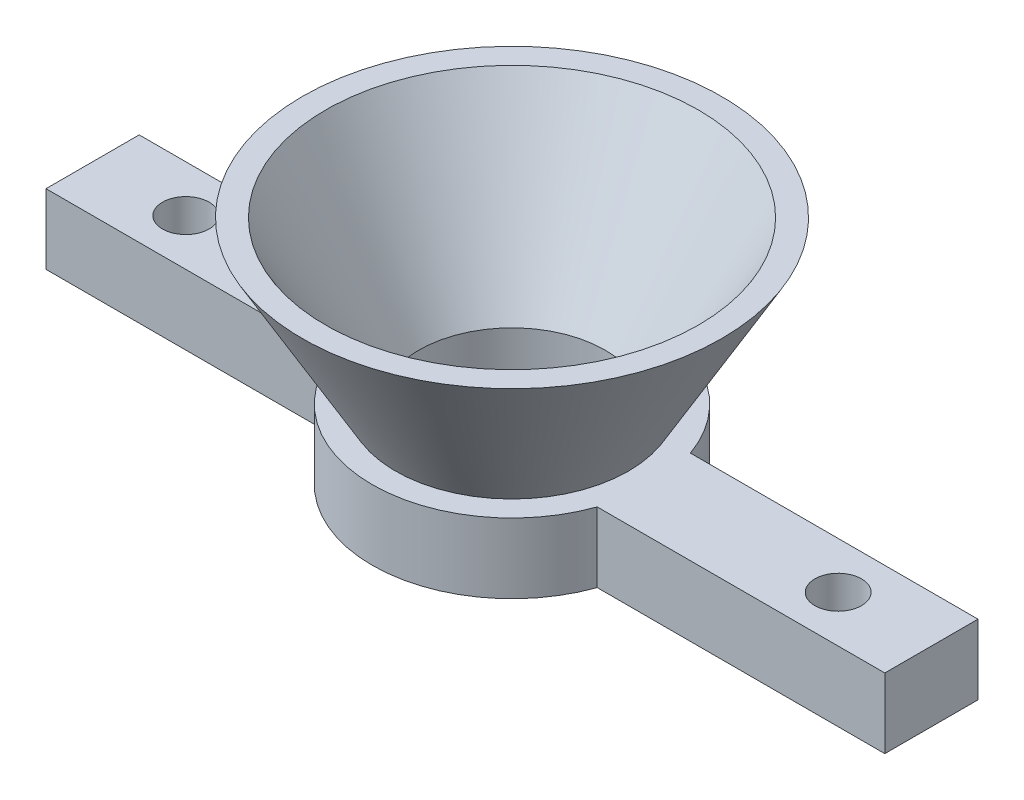
from build123d import *

# Parameters (mm, degrees)
SKETCH1_R           = 0.79375
BOSS_EXTRUDE1_DEPTH = 1.190625


with BuildPart() as part:
    # Sketch1 → Boss-Extrude1 (new, symmetric)
    # profile 1 of 14: a face of its own
    with BuildSketch(Plane(origin=(0, 0, 0), x_dir=(1, 0, 0), z_dir=(0, 1, 0))):
        with BuildLine():
            ThreePointArc((-4.682314967, -0.870248702), (-4.742411374, -0.436967517), (-4.7625, 0))
            ThreePointArc((-4.7625, 0), (-4.69391314, 0.805348174), (-4.490128061, 1.5875))
            Line((-4.490128061, 1.5875), (-14.2875, 1.5875))
            Line((-14.2875, 1.5875), (-14.2875, -1.5875))
            Line((-14.2875, -1.5875), (-5.924630657, -1.5875))
            Line((-5.924630657, -1.5875), (-4.682314967, -0.870248702))
        make_face()
        with Locations(Location((-11.1125, 0, 0), (0, 0, 90))):
            Circle(SKETCH1_R, mode=Mode.SUBTRACT)
    # profile 2 of 14: a face of its own
    with BuildSketch(Plane(origin=(0, 0, 0), x_dir=(1, 0, 0), z_dir=(0, 1, 0))):
        with BuildLine():
            ThreePointArc((-2.749630657, 1.5875), (0, 3.175), (2.749630657, 1.5875))
            Line((2.749630657, 1.5875), (4.490128061, 1.5875))
            ThreePointArc((4.490128061, 1.5875), (0, 4.7625), (-4.490128061, 1.5875))
            Line((-4.490128061, 1.5875), (-2.749630657, 1.5875))
        make_face()
    # profile 3 of 14: a face of its own
    with BuildSketch(Plane(origin=(0, 0, 0), x_dir=(1, 0, 0), z_dir=(0, 1, 0))):
        with BuildLine():
            ThreePointArc((4.490128061, 1.5875), (4.69391314, 0.805348174), (4.7625, 0))
            ThreePointArc((4.7625, 0), (4.742411374, -0.436967517), (4.682314967, -0.870248702))
            Line((4.682314967, -0.870248702), (5.924630657, -1.5875))
            Line((5.924630657, -1.5875), (14.2875, -1.5875))
            Line((14.2875, -1.5875), (14.2875, 1.5875))
            Line((14.2875, 1.5875), (4.490128061, 1.5875))
        make_face()
        with Locations(Location((11.1125, 0, 0), (0, 0, 90))):
            Circle(SKETCH1_R, mode=Mode.SUBTRACT)
    # profile 4 of 14: a face of its own
    with BuildSketch(Plane(origin=(0, 0, 0), x_dir=(1, 0, 0), z_dir=(0, 1, 0))):
        with BuildLine():
            ThreePointArc((2.749630657, 1.5875), (3.066814498, 0.821750468), (3.175, 0))
            Line((3.175, 0), (4.7625, 0))
            ThreePointArc((4.7625, 0), (4.69391314, 0.805348174), (4.490128061, 1.5875))
            Line((4.490128061, 1.5875), (2.749630657, 1.5875))
        make_face()
    # profile 5 of 14: a face of its own
    with BuildSketch(Plane(origin=(0, 0, 0), x_dir=(1, 0, 0), z_dir=(0, 1, 0))):
        with BuildLine():
            Line((-4.7625, 0), (-3.175, 0))
            ThreePointArc((-3.175, 0), (-3.066814498, 0.821750468), (-2.749630657, 1.5875))
            Line((-2.749630657, 1.5875), (-4.490128061, 1.5875))
            ThreePointArc((-4.490128061, 1.5875), (-4.69391314, 0.805348174), (-4.7625, 0))
        make_face()
    # profile 6 of 14: a face of its own
    with BuildSketch(Plane(origin=(0, 0, 0), x_dir=(1, 0, 0), z_dir=(0, 1, 0))):
        with BuildLine():
            Line((4.7625, 0), (3.175, 0))
            Line((3.175, 0), (4.682314967, -0.870248702))
            ThreePointArc((4.682314967, -0.870248702), (4.742411374, -0.436967517), (4.7625, 0))
        make_face()
    # profile 7 of 14: a face of its own
    with BuildSketch(Plane(origin=(0, 0, 0), x_dir=(1, 0, 0), z_dir=(0, 1, 0))):
        with BuildLine():
            Line((4.682314967, -0.870248702), (3.175, 0))
            ThreePointArc((3.175, 0), (3.066814498, -0.821750468), (2.749630657, -1.5875))
            Line((2.749630657, -1.5875), (4.490128061, -1.5875))
            ThreePointArc((4.490128061, -1.5875), (4.600221748, -1.232625702), (4.682314967, -0.870248702))
        make_face()
    # profile 8 of 14: a face of its own
    with BuildSketch(Plane(origin=(0, 0, 0), x_dir=(1, 0, 0), z_dir=(0, 1, 0))):
        with BuildLine():
            Line((4.490128061, -1.5875), (2.749630657, -1.5875))
            ThreePointArc((2.749630657, -1.5875), (0, -3.175), (-2.749630657, -1.5875))
            Line((-2.749630657, -1.5875), (-4.490128061, -1.5875))
            ThreePointArc((-4.490128061, -1.5875), (0, -4.7625), (4.490128061, -1.5875))
        make_face()
    # profile 9 of 14: a face of its own
    with BuildSketch(Plane(origin=(0, 0, 0), x_dir=(1, 0, 0), z_dir=(0, 1, 0))):
        with BuildLine():
            ThreePointArc((-2.749630657, -1.5875), (-3.066814498, -0.821750468), (-3.175, 0))
            Line((-3.175, 0), (-4.682314967, -0.870248702))
            ThreePointArc((-4.682314967, -0.870248702), (-4.600221748, -1.232625702), (-4.490128061, -1.5875))
            Line((-4.490128061, -1.5875), (-2.749630657, -1.5875))
        make_face()
    # profile 10 of 14: a face of its own
    with BuildSketch(Plane(origin=(0, 0, 0), x_dir=(1, 0, 0), z_dir=(0, 1, 0))):
        with BuildLine():
            ThreePointArc((2.749630657, 1.5875), (3.066814498, 0.821750468), (3.175, 0))
            Line((3.175, 0), (4.7625, 0))
            ThreePointArc((4.7625, 0), (4.69391314, 0.805348174), (4.490128061, 1.5875))
            Line((4.490128061, 1.5875), (2.749630657, 1.5875))
        make_face()
    # profile 11 of 14: a face of its own
    with BuildSketch(Plane(origin=(0, 0, 0), x_dir=(1, 0, 0), z_dir=(0, 1, 0))):
        with BuildLine():
            Line((-4.7625, 0), (-3.175, 0))
            ThreePointArc((-3.175, 0), (-3.066814498, 0.821750468), (-2.749630657, 1.5875))
            Line((-2.749630657, 1.5875), (-4.490128061, 1.5875))
            ThreePointArc((-4.490128061, 1.5875), (-4.69391314, 0.805348174), (-4.7625, 0))
        make_face()
    # profile 12 of 14: a face of its own
    with BuildSketch(Plane(origin=(0, 0, 0), x_dir=(1, 0, 0), z_dir=(0, 1, 0))):
        with BuildLine():
            Line((-4.682314967, -0.870248702), (-3.175, 0))
            Line((-3.175, 0), (-4.7625, 0))
            ThreePointArc((-4.7625, 0), (-4.742411374, -0.436967517), (-4.682314967, -0.870248702))
        make_face()
    # profile 13 of 14: a face of its own
    with BuildSketch(Plane(origin=(0, 0, 0), x_dir=(1, 0, 0), z_dir=(0, 1, 0))):
        with BuildLine():
            Line((5.924630657, -1.5875), (4.682314967, -0.870248702))
            ThreePointArc((4.682314967, -0.870248702), (4.600221748, -1.232625702), (4.490128061, -1.5875))
            Line((4.490128061, -1.5875), (5.924630657, -1.5875))
        make_face()
    # profile 14 of 14: a face of its own
    with BuildSketch(Plane(origin=(0, 0, 0), x_dir=(1, 0, 0), z_dir=(0, 1, 0))):
        with BuildLine():
            ThreePointArc((-4.490128061, -1.5875), (-4.600221748, -1.232625702), (-4.682314967, -0.870248702))
            Line((-4.682314967, -0.870248702), (-5.924630657, -1.5875))
            Line((-5.924630657, -1.5875), (-4.490128061, -1.5875))
        make_face()
    extrude(amount=BOSS_EXTRUDE1_DEPTH, both=True)

    # Sketch2 → Revolve2 (revolve)
    with BuildSketch(Plane.XY, mode=Mode.PRIVATE) as revolve2_sk:
        Polygon((-3.175, 1.190625), (-6.35, 6.689886314), (-7.14375, 6.689886314), (-3.96875, 1.190625), align=None)
    revolve(revolve2_sk.sketch.rotate(Axis((0, -1000, 0), (0, 1, 0)), 270), axis=Axis((0, -1000, 0), (0, 1, 0)))


solid = part.part
